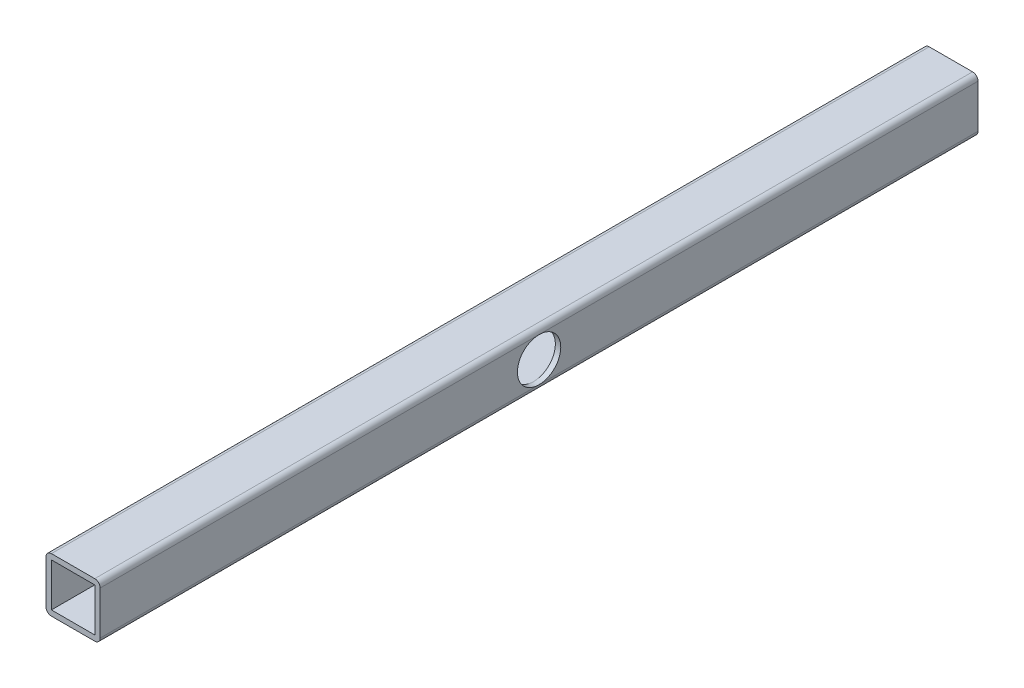
from build123d import *

# Parameters (mm, degrees)
SKETCH1_W           = 120
SKETCH1_H           = 120
BOSS_EXTRUDE1_DEPTH = 5
SKETCH2_W           = 100
SKETCH2_H           = 100
SKETCH2_W_2         = 80
SKETCH2_H_2         = 80
EXTRUDE_THIN1_DEPTH = 1620
FILLET1_R           = 10
SKETCH4_W           = 28.971165854
SKETCH4_H           = 139.886747586
CUT_EXTRUDE1_DEPTH  = 1631.529055246
SKETCH5_R           = 40
CUT_EXTRUDE2_DEPTH  = 1629.841612926


with BuildPart() as part:
    # Sketch1 → Boss-Extrude1 (new body)
    with BuildSketch(Plane.XY):
        Rectangle(SKETCH1_W, SKETCH1_H)
    extrude(amount=BOSS_EXTRUDE1_DEPTH)

    # Sketch2 → Extrude-Thin1 (add)
    with BuildSketch(Plane.XY.offset(5)):
        Rectangle(SKETCH2_W, SKETCH2_H)
        Rectangle(SKETCH2_W_2, SKETCH2_H_2, mode=Mode.SUBTRACT)
    extrude(amount=EXTRUDE_THIN1_DEPTH)

    # Fillet1
    fillet1_edges = [part.edges().sort_by_distance(p)[0] for p in [
        (50, -50, 815),
        (50, 50, 815),
        (-50, 50, 815),
        (-50, -50, 815),
    ]]
    fillet(fillet1_edges, radius=FILLET1_R)

    # Sketch4 → Cut-Extrude1 (cut, through all)
    with BuildSketch(Plane(origin=(60, 0, 0), x_dir=(0, 0, -1), z_dir=(1, 0, 0))):
        with Locations((9.485582927, 4.056648122)):
            Rectangle(SKETCH4_W, SKETCH4_H)
    extrude(amount=-CUT_EXTRUDE1_DEPTH, mode=Mode.SUBTRACT)

    # Sketch5 → Cut-Extrude2 (cut, through all)
    with BuildSketch(Plane(origin=(50, 0, 0), x_dir=(0, 0, -1), z_dir=(1, 0, 0))):
        with Locations(Location((-815, 0, 0), (0, 0, 270))):
            Circle(SKETCH5_R)
    extrude(amount=-CUT_EXTRUDE2_DEPTH, mode=Mode.SUBTRACT)


solid = part.part
